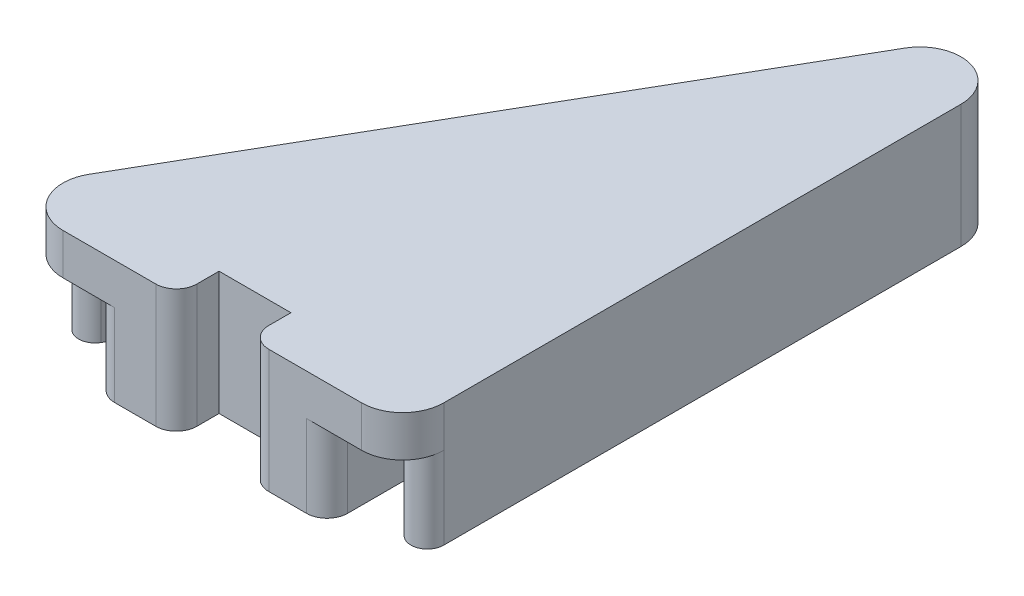
from build123d import *

# Parameters (mm, degrees)
BOSS_EXTRUDE1_DEPTH              = 19.05
SKETCH2_W                        = 11.1125
SKETCH2_H                        = 6.604
CUT_EXTRUDE1_DEPTH               = 112.391012889
CUT_EXTRUDE2_DEPTH               = 12.7
FILLET1_R                        = 3.175
F_1_8_0_125_DIAMETER_HOLE1_D     = 3.175
F_1_8_0_125_DIAMETER_HOLE1_DEPTH = 11.1252
F_1_8_0_125_DIAMETER_HOLE1_TIP   = 0.953866233


with BuildPart() as part:
    # Sketch1 → Boss-Extrude1 (new body)
    with BuildSketch(Plane(origin=(0, 0, 0), x_dir=(1, 0, 0), z_dir=(0, 1, 0))):
        with BuildLine():
            Line((0, 6.35), (0, 86.286703653))
            ThreePointArc((0, 86.286703653), (-4.706499064, 92.420332649), (-11.849261314, 89.461703653))
            Line((-11.849261314, 89.461703653), (-58.000738686, 9.525))
            ThreePointArc((-58.000738686, 9.525), (-58.000738686, 3.175), (-52.501477372, 0))
            Line((-52.501477372, 0), (-6.35, 0))
            ThreePointArc((-6.35, 0), (-1.859871939, 1.859871939), (0, 6.35))
        make_face()
    extrude(amount=BOSS_EXTRUDE1_DEPTH)

    # Sketch2 → Cut-Extrude1 (cut, through all)
    with BuildSketch(Plane(origin=(0, 19.05, 0), x_dir=(1, 0, 0), z_dir=(0, 1, 0))):
        with Locations((-29.425738686, 3.302)):
            Rectangle(SKETCH2_W, SKETCH2_H)
    extrude(amount=-CUT_EXTRUDE1_DEPTH, mode=Mode.SUBTRACT)

    # Sketch3 → Cut-Extrude2 (cut)
    with BuildSketch(Plane(origin=(0, 0, 0), x_dir=(1, 0, 0), z_dir=(0, 1, 0))):
        with BuildLine():
            Line((-22.151280202, 48.250083518), (-50.00847891, 0))
            Line((-50.00847891, 0), (-52.501477372, 0))
            ThreePointArc((-52.501477372, 0), (-58.000738686, 3.175), (-58.000738686, 9.525))
            ThreePointArc((-58.000738686, 9.525), (-57.07103416, 6.055295474), (-53.601329635, 6.985))
            Line((-53.601329635, 6.985), (-32.17376215, 44.098635567))
            Line((-32.17376215, 44.098635567), (-27.870511969, 51.552083518))
            ThreePointArc((-27.870511969, 51.552083518), (-14.132338403, 57.242621331), (-5.08, 45.445384241))
            Line((-5.08, 45.445384241), (-5.08, 36.838883879))
            Line((-5.08, 36.838883879), (-5.08, 6.35))
            ThreePointArc((-5.08, 6.35), (-2.54, 3.81), (0, 6.35))
            ThreePointArc((0, 6.35), (-1.859871939, 1.859871939), (-6.35, 0))
            Line((-6.35, 0), (-11.684, 0))
            Line((-11.684, 0), (-11.684, 45.445384241))
            ThreePointArc((-11.684, 45.445384241), (-15.841579377, 50.863647174), (-22.151280202, 48.250083518))
        make_face()
    extrude(amount=CUT_EXTRUDE2_DEPTH, mode=Mode.SUBTRACT)

    # Fillet1
    fillet1_edges = [part.edges().sort_by_distance(p)[0] for p in [
        (-34.981988686, 9.525, 0),
        (-23.869488686, 9.525, 0),
        (-50.00847891, 6.35, 0),
        (-11.684, 6.35, 0),
    ]]
    fillet(fillet1_edges, radius=FILLET1_R)

    # 1/8 (0.125) Diameter Hole1
    with Locations(Plane(origin=(0, 0, 0), x_dir=(-1, 0, 0), z_dir=(0, -1, 0))):
        with Locations((9.637001873, 74.019445659), (18.796, 14.224), (34.684248681, 14.224)):
            Hole(F_1_8_0_125_DIAMETER_HOLE1_D / 2, depth=F_1_8_0_125_DIAMETER_HOLE1_DEPTH)
            with Locations((0, 0, -(F_1_8_0_125_DIAMETER_HOLE1_DEPTH + F_1_8_0_125_DIAMETER_HOLE1_TIP / 2))):  # 118° drill point
                Cone(0, F_1_8_0_125_DIAMETER_HOLE1_D / 2, F_1_8_0_125_DIAMETER_HOLE1_TIP, mode=Mode.SUBTRACT)


solid = part.part
